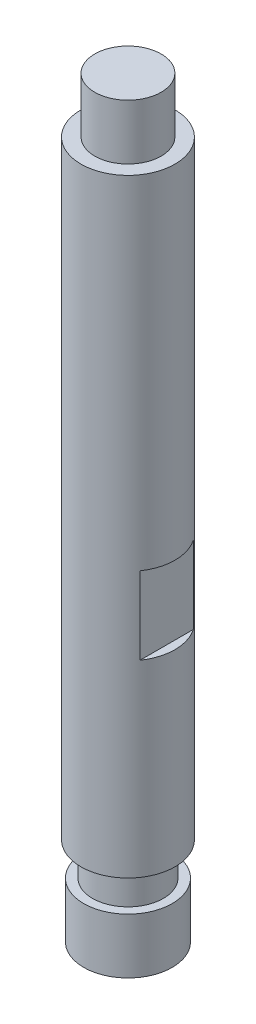
from build123d import *

# Parameters (mm, degrees)
SKETCH1_R               = 4.25
BOSS_EXTRUDE1_DEPTH     = 55
SKETCH4_R               = 3
BOSS_EXTRUDE3_DEPTH     = 5
CUT_EXTRUDE2_DEPTH      = 10
CUT_EXTRUDE2_DEPTH_BACK = 10
SKETCH5_W               = 0.75
SKETCH5_H               = 7
SKETCH3_R               = 4
BOSS_EXTRUDE2_DEPTH     = 8
SKETCH6_W               = 0.8
SKETCH6_H               = 3


with BuildPart() as part:
    # Sketch1 → Boss-Extrude1 (new body)
    with BuildSketch(Plane(origin=(0, 0, 0), x_dir=(1, 0, 0), z_dir=(0, 1, 0))):
        Circle(SKETCH1_R)
    extrude(amount=BOSS_EXTRUDE1_DEPTH)

    # Sketch4 → Boss-Extrude3 (add)
    with BuildSketch(Plane(origin=(0, 55, 0), x_dir=(1, 0, 0), z_dir=(0, 1, 0))):
        Circle(SKETCH4_R)
    extrude(amount=BOSS_EXTRUDE3_DEPTH)

    # Sketch5 → Cut-Extrude2 (cut, two sides: drawn at the far end of the back side and taken through both)
    with BuildSketch(Plane.XY.offset(-CUT_EXTRUDE2_DEPTH_BACK)):
        with Locations((-3.875, 20.5)):
            Rectangle(SKETCH5_W, SKETCH5_H)
        with Locations((3.875, 20.5)):
            Rectangle(SKETCH5_W, SKETCH5_H)
    extrude(amount=CUT_EXTRUDE2_DEPTH + CUT_EXTRUDE2_DEPTH_BACK, mode=Mode.SUBTRACT)

    # Sketch3 → Boss-Extrude2 (add)
    with BuildSketch(Plane(origin=(0, 0, 0), x_dir=(1, 0, 0), z_dir=(0, 1, 0))):
        Circle(SKETCH3_R)
    extrude(amount=-BOSS_EXTRUDE2_DEPTH)

    # Sketch6 → Cut-Revolve1 (revolve, cut)
    with BuildSketch(Plane(origin=(0, 0, 0), x_dir=(0, 0, -1), z_dir=(1, 0, 0))):
        with Locations((3.6, -1.5)):
            Rectangle(SKETCH6_W, SKETCH6_H)
    revolve(axis=Axis((0, 55, 0), (0, -1, 0)), mode=Mode.SUBTRACT)


solid = part.part
